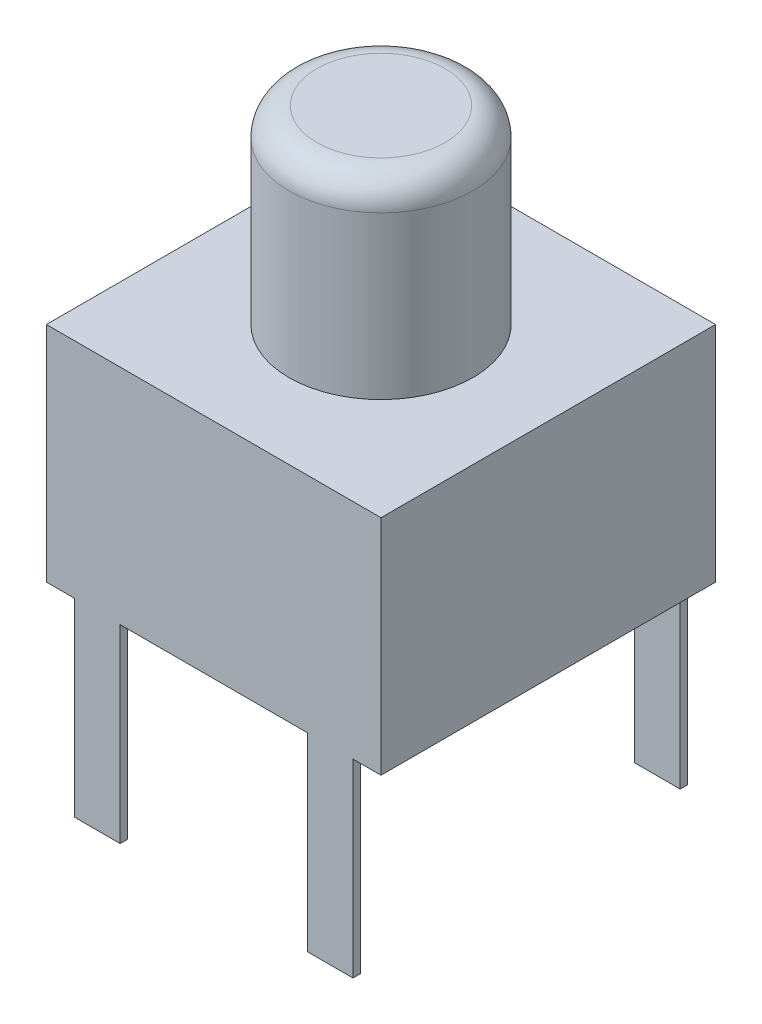
from build123d import *

# Parameters (mm, degrees)
ESQUISSE1_W                                = 6
ESQUISSE1_H                                = 6
BOSS_EXTRU_1_DEPTH                         = 4
ESQUISSE2_R                                = 1.65
BOSS_EXTRU_2_DEPTH                         = 3.4
CONG_1_R                                   = 0.5
ESQUISSE3_W                                = 0.819968842
ESQUISSE3_H                                = 0.132597198
BOSS_EXTRU_3_DEPTH                         = 3.4
SYM_TRIE1_AT_THE_SECOND_PLANE_COPY_1_SKE_W = 0.819968842
SYM_TRIE1_AT_THE_SECOND_PLANE_COPY_1_SKE_H = 0.132597198
SYM_TRIE1_AT_THE_SECOND_PLANE_COPY_1_DEPTH = 3.4


with BuildPart() as part:
    # Esquisse1 → Boss.-Extru.1 (new body)
    with BuildSketch(Plane(origin=(0, 0, 0), x_dir=(1, 0, 0), z_dir=(0, 1, 0))):
        Rectangle(ESQUISSE1_W, ESQUISSE1_H)
    extrude(amount=BOSS_EXTRU_1_DEPTH)

    # Esquisse2 → Boss.-Extru.2 (add)
    with BuildSketch(Plane(origin=(0, 4, 0), x_dir=(1, 0, 0), z_dir=(0, 1, 0))):
        Circle(ESQUISSE2_R)
    extrude(amount=BOSS_EXTRU_2_DEPTH)

    # Congé1
    cong_1_edges = [part.edges().sort_by_distance(p)[0] for p in [
        (-1.65, 7.4, 0),
    ]]
    fillet(cong_1_edges, radius=CONG_1_R)

    # Esquisse3 → Boss.-Extru.3 (add)
    with BuildSketch(Plane.XZ):
        with Locations((-2.087621823, -2.933701401)):
            Rectangle(ESQUISSE3_W, ESQUISSE3_H)
    boss_extru_3 = extrude(amount=BOSS_EXTRU_3_DEPTH)

    # Symétrie1: Boss.-Extru.3 across plane
    add(boss_extru_3.mirror(Plane(origin=(0, 0, 0), x_dir=(0, 0, 1), z_dir=(1, 0, 0))))

    # Symétrie1 at the second plane: Boss.-Extru.3 across plane
    add(boss_extru_3.mirror(Plane.XY))

    # Symétrie1 at the second plane copy 1 ske → Symétrie1 at the second plane copy 1 (add)
    with BuildSketch(Plane(origin=(0, 0, 0), x_dir=(-1, 0, 0), z_dir=(0, -1, 0))):
        with Locations((-2.087621823, -2.933701401)):
            Rectangle(SYM_TRIE1_AT_THE_SECOND_PLANE_COPY_1_SKE_W, SYM_TRIE1_AT_THE_SECOND_PLANE_COPY_1_SKE_H)
    extrude(amount=SYM_TRIE1_AT_THE_SECOND_PLANE_COPY_1_DEPTH)


solid = part.part
